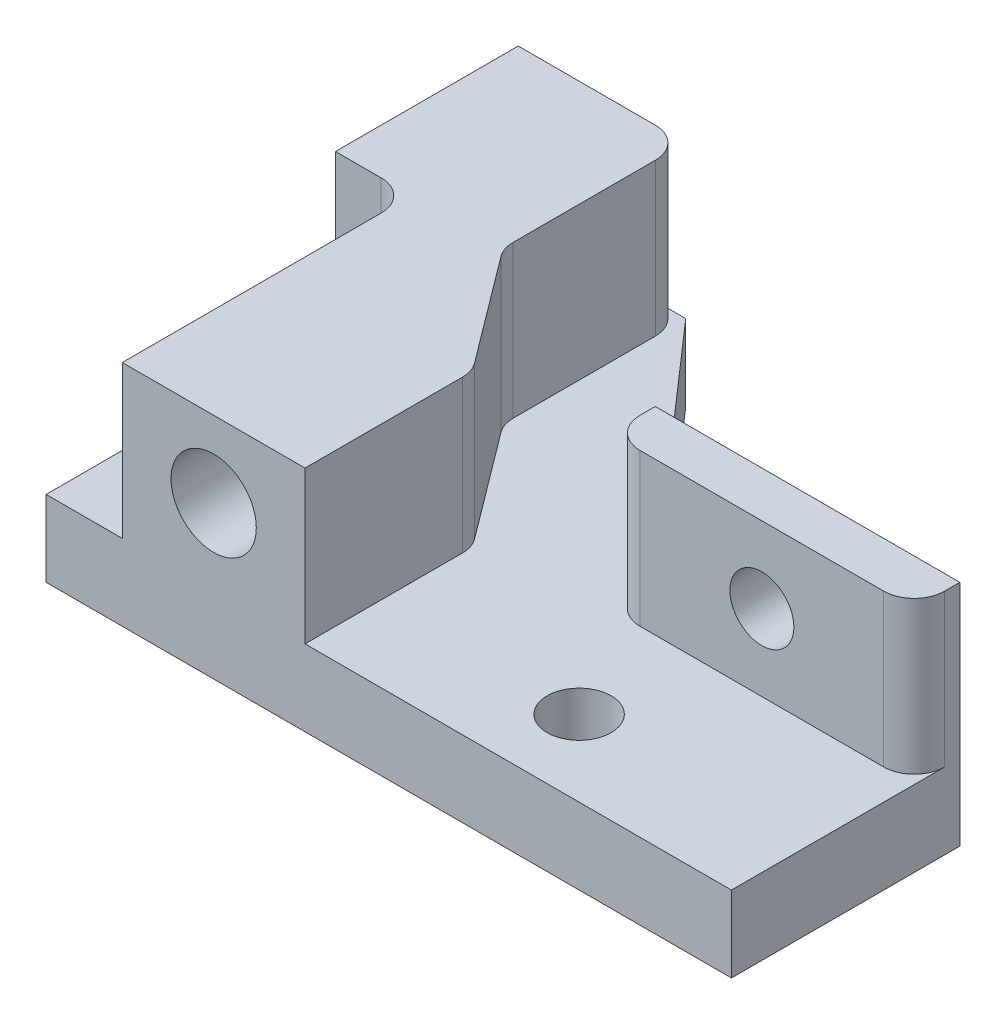
from build123d import *

# Parameters (mm, degrees)
ESQUISSE1_R             = 2.1
BOSS_EXTRU_1_DEPTH      = 5
ESQUISSE2_W             = 20
ESQUISSE2_H             = 3
BOSS_EXTRU_2_DEPTH      = 10
ESQUISSE3_R             = 2.8
ENL_V_MAT_EXTRU_1_DEPTH = 9.1
ESQUISSE4_R             = 2.1
ENL_V_MAT_EXTRU_2_DEPTH = 9.1
CONG_2_R                = 2
ESQUISSE5_R             = 2.8
ENL_V_MAT_EXTRU_3_DEPTH = 9.1


with BuildPart() as part:
    # Esquisse1 → Boss.-Extru.1 (new body)
    with BuildSketch(Plane(origin=(0, 0, 0), x_dir=(1, 0, 0), z_dir=(0, 1, 0))):
        Polygon((20, 0), (20, -15), (-20, -15), (-25, -15), (-25, 16), (-14, 16), (0, 0), align=None)
        with Locations(Location((5, -10, 0), (0, 0, 270))):
            Circle(ESQUISSE1_R, mode=Mode.SUBTRACT)
    extrude(amount=BOSS_EXTRU_1_DEPTH)

    # Esquisse2 → Boss.-Extru.2 (add)
    with BuildSketch(Plane(origin=(0, 5, 0), x_dir=(1, 0, 0), z_dir=(0, 1, 0))):
        with Locations((10, -1.5)):
            Rectangle(ESQUISSE2_W, ESQUISSE2_H)
        Polygon((-14, 4), (-14, 16), (-25, 16), (-25, 4), (-20, 4), (-20, -15), (-8, -15), (-8, -4), align=None)
    extrude(amount=BOSS_EXTRU_2_DEPTH)

    # Esquisse3 → Enlèv. mat.-Extru.1 (cut)
    with BuildSketch(Plane.XY.offset(15)):
        with Locations((-14, 10)):
            Circle(ESQUISSE3_R)
    extrude(amount=-ENL_V_MAT_EXTRU_1_DEPTH, mode=Mode.SUBTRACT)

    # Esquisse4 → Enlèv. mat.-Extru.2 (cut)
    with BuildSketch(Plane.XY.offset(3)):
        with Locations((10, 10)):
            Circle(ESQUISSE4_R)
    extrude(amount=-ENL_V_MAT_EXTRU_2_DEPTH, mode=Mode.SUBTRACT)

    # Congé2
    cong_2_edges = [part.edges().sort_by_distance(p)[0] for p in [
        (0, 10, 3),
        (20, 10, 3),
        (-20, 10, -4),
        (-8, 10, 4),
        (-14, 10, -4),
        (-14, 10, -16),
    ]]
    fillet(cong_2_edges, radius=CONG_2_R)

    # Esquisse5 → Enlèv. mat.-Extru.3 (cut)
    with BuildSketch(Plane.ZY.offset(25)):
        with Locations((-10, 10)):
            Circle(ESQUISSE5_R)
    extrude(amount=-ENL_V_MAT_EXTRU_3_DEPTH, mode=Mode.SUBTRACT)


solid = part.part
